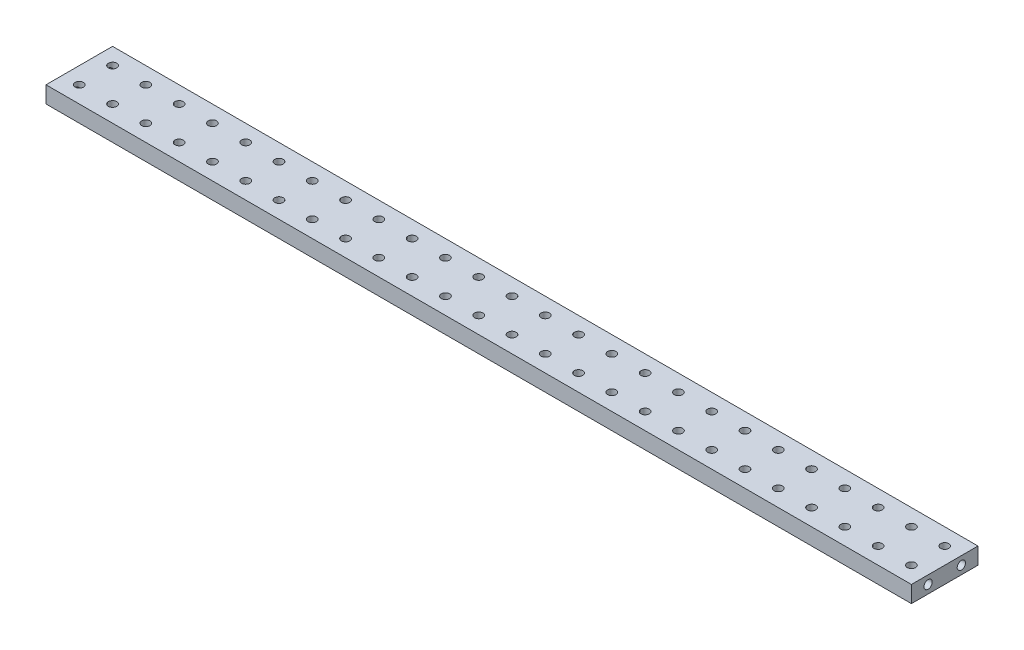
from build123d import *

# Parameters (mm, degrees)
SKETCH1_W           = 660.4
SKETCH1_H           = 50.8
BOSS_EXTRUDE1_DEPTH = 12.7
SKETCH2_R           = 3.175
CUT_EXTRUDE1_DEPTH  = 12.7
CUT_EXTRUDE2_START  = -12.7
SKETCH3_R           = 3.175
CUT_EXTRUDE2_DEPTH  = 12.7
SKETCH4_R           = 3.175
CUT_EXTRUDE3_DEPTH  = 332.418904108


with BuildPart() as part:
    # Sketch1 → Boss-Extrude1 (new body)
    with BuildSketch(Plane(origin=(0, 0, 0), x_dir=(1, 0, 0), z_dir=(0, 1, 0))):
        Rectangle(SKETCH1_W, SKETCH1_H)
    extrude(amount=BOSS_EXTRUDE1_DEPTH)

    # Sketch2 → Cut-Extrude1 (cut)
    with BuildSketch(Plane.ZY.offset(330.2)):
        with Locations((-12.7, 6.35)):
            Circle(SKETCH2_R)
        with Locations((12.7, 6.35)):
            Circle(SKETCH2_R)
    extrude(amount=-CUT_EXTRUDE1_DEPTH, mode=Mode.SUBTRACT)

    # Sketch3 → Cut-Extrude2 (cut)
    with BuildSketch(Plane(origin=(330.2, 0, 0), x_dir=(0, 0, -1), z_dir=(1, 0, 0)).offset(CUT_EXTRUDE2_START)):
        with Locations(Location((-12.7, 6.35, 0), (0, 0, 180))):
            Circle(SKETCH3_R)
        with Locations(Location((12.7, 6.35, 0), (0, 0, 180))):
            Circle(SKETCH3_R)
    extrude(amount=CUT_EXTRUDE2_DEPTH, mode=Mode.SUBTRACT)

    # Sketch4 → Cut-Extrude3 (cut, through all)
    with BuildSketch(Plane(origin=(0, 12.7, 0), x_dir=(1, 0, 0), z_dir=(0, 1, 0))):
        with Locations(Location((-317.5, 12.7, 0), (0, 0, 270))):
            Circle(SKETCH4_R)
        with Locations(Location((-292.1, 12.7, 0), (0, 0, 270))):
            Circle(SKETCH4_R)
        with Locations(Location((-266.7, 12.7, 0), (0, 0, 270))):
            Circle(SKETCH4_R)
        with Locations(Location((-241.3, 12.7, 0), (0, 0, 270))):
            Circle(SKETCH4_R)
        with Locations(Location((-215.9, 12.7, 0), (0, 0, 270))):
            Circle(SKETCH4_R)
        with Locations(Location((-190.5, 12.7, 0), (0, 0, 270))):
            Circle(SKETCH4_R)
        with Locations(Location((-165.1, 12.7, 0), (0, 0, 270))):
            Circle(SKETCH4_R)
        with Locations(Location((-139.7, 12.7, 0), (0, 0, 270))):
            Circle(SKETCH4_R)
        with Locations(Location((-114.3, 12.7, 0), (0, 0, 270))):
            Circle(SKETCH4_R)
        with Locations(Location((-88.9, 12.7, 0), (0, 0, 270))):
            Circle(SKETCH4_R)
        with Locations(Location((-63.5, 12.7, 0), (0, 0, 270))):
            Circle(SKETCH4_R)
        with Locations(Location((-38.1, 12.7, 0), (0, 0, 270))):
            Circle(SKETCH4_R)
        with Locations(Location((-12.7, 12.7, 0), (0, 0, 270))):
            Circle(SKETCH4_R)
        with Locations(Location((12.7, 12.7, 0), (0, 0, 270))):
            Circle(SKETCH4_R)
        with Locations(Location((38.1, 12.7, 0), (0, 0, 270))):
            Circle(SKETCH4_R)
        with Locations(Location((63.5, 12.7, 0), (0, 0, 270))):
            Circle(SKETCH4_R)
        with Locations(Location((88.9, 12.7, 0), (0, 0, 270))):
            Circle(SKETCH4_R)
        with Locations(Location((114.3, 12.7, 0), (0, 0, 270))):
            Circle(SKETCH4_R)
        with Locations(Location((139.7, 12.7, 0), (0, 0, 270))):
            Circle(SKETCH4_R)
        with Locations(Location((165.1, 12.7, 0), (0, 0, 270))):
            Circle(SKETCH4_R)
        with Locations(Location((190.5, 12.7, 0), (0, 0, 270))):
            Circle(SKETCH4_R)
        with Locations(Location((215.9, 12.7, 0), (0, 0, 270))):
            Circle(SKETCH4_R)
        with Locations(Location((241.3, 12.7, 0), (0, 0, 270))):
            Circle(SKETCH4_R)
        with Locations(Location((266.7, 12.7, 0), (0, 0, 270))):
            Circle(SKETCH4_R)
        with Locations(Location((-292.1, -12.7, 0), (0, 0, 270))):
            Circle(SKETCH4_R)
        with Locations(Location((-266.7, -12.7, 0), (0, 0, 270))):
            Circle(SKETCH4_R)
        with Locations(Location((-241.3, -12.7, 0), (0, 0, 270))):
            Circle(SKETCH4_R)
        with Locations(Location((-215.9, -12.7, 0), (0, 0, 270))):
            Circle(SKETCH4_R)
        with Locations(Location((-190.5, -12.7, 0), (0, 0, 270))):
            Circle(SKETCH4_R)
        with Locations(Location((-165.1, -12.7, 0), (0, 0, 270))):
            Circle(SKETCH4_R)
        with Locations(Location((-139.7, -12.7, 0), (0, 0, 270))):
            Circle(SKETCH4_R)
        with Locations(Location((-114.3, -12.7, 0), (0, 0, 270))):
            Circle(SKETCH4_R)
        with Locations(Location((-88.9, -12.7, 0), (0, 0, 270))):
            Circle(SKETCH4_R)
        with Locations(Location((-63.5, -12.7, 0), (0, 0, 270))):
            Circle(SKETCH4_R)
        with Locations(Location((-38.1, -12.7, 0), (0, 0, 270))):
            Circle(SKETCH4_R)
        with Locations(Location((-12.7, -12.7, 0), (0, 0, 270))):
            Circle(SKETCH4_R)
        with Locations(Location((12.7, -12.7, 0), (0, 0, 270))):
            Circle(SKETCH4_R)
        with Locations(Location((38.1, -12.7, 0), (0, 0, 270))):
            Circle(SKETCH4_R)
        with Locations(Location((63.5, -12.7, 0), (0, 0, 270))):
            Circle(SKETCH4_R)
        with Locations(Location((88.9, -12.7, 0), (0, 0, 270))):
            Circle(SKETCH4_R)
        with Locations(Location((114.3, -12.7, 0), (0, 0, 270))):
            Circle(SKETCH4_R)
        with Locations(Location((139.7, -12.7, 0), (0, 0, 270))):
            Circle(SKETCH4_R)
        with Locations(Location((165.1, -12.7, 0), (0, 0, 270))):
            Circle(SKETCH4_R)
        with Locations(Location((190.5, -12.7, 0), (0, 0, 270))):
            Circle(SKETCH4_R)
        with Locations(Location((215.9, -12.7, 0), (0, 0, 270))):
            Circle(SKETCH4_R)
        with Locations(Location((241.3, -12.7, 0), (0, 0, 270))):
            Circle(SKETCH4_R)
        with Locations(Location((266.7, -12.7, 0), (0, 0, 270))):
            Circle(SKETCH4_R)
        with Locations(Location((-317.5, -12.7, 0), (0, 0, 270))):
            Circle(SKETCH4_R)
        with Locations(Location((292.1, 12.7, 0), (0, 0, 270))):
            Circle(SKETCH4_R)
        with Locations(Location((317.5, 12.7, 0), (0, 0, 270))):
            Circle(SKETCH4_R)
        with Locations((342.9, 12.7)):
            Circle(SKETCH4_R)
        with Locations((368.3, 12.7)):
            Circle(SKETCH4_R)
        with Locations((393.7, 12.7)):
            Circle(SKETCH4_R)
        with Locations((419.1, 12.7)):
            Circle(SKETCH4_R)
        with Locations((444.5, 12.7)):
            Circle(SKETCH4_R)
        with Locations((469.9, 12.7)):
            Circle(SKETCH4_R)
        with Locations((495.3, 12.7)):
            Circle(SKETCH4_R)
        with Locations((520.7, 12.7)):
            Circle(SKETCH4_R)
        with Locations((546.1, 12.7)):
            Circle(SKETCH4_R)
        with Locations((571.5, 12.7)):
            Circle(SKETCH4_R)
        with Locations((596.9, 12.7)):
            Circle(SKETCH4_R)
        with Locations((622.3, 12.7)):
            Circle(SKETCH4_R)
        with Locations((647.7, 12.7)):
            Circle(SKETCH4_R)
        with Locations((673.1, 12.7)):
            Circle(SKETCH4_R)
        with Locations((698.5, 12.7)):
            Circle(SKETCH4_R)
        with Locations((723.9, 12.7)):
            Circle(SKETCH4_R)
        with Locations((749.3, 12.7)):
            Circle(SKETCH4_R)
        with Locations((774.7, 12.7)):
            Circle(SKETCH4_R)
        with Locations((800.1, 12.7)):
            Circle(SKETCH4_R)
        with Locations((825.5, 12.7)):
            Circle(SKETCH4_R)
        with Locations((850.9, 12.7)):
            Circle(SKETCH4_R)
        with Locations((876.3, 12.7)):
            Circle(SKETCH4_R)
        with Locations(Location((292.1, -12.7, 0), (0, 0, 270))):
            Circle(SKETCH4_R)
        with Locations(Location((317.5, -12.7, 0), (0, 0, 270))):
            Circle(SKETCH4_R)
        with Locations((342.9, -12.7)):
            Circle(SKETCH4_R)
        with Locations((368.3, -12.7)):
            Circle(SKETCH4_R)
        with Locations((393.7, -12.7)):
            Circle(SKETCH4_R)
        with Locations((419.1, -12.7)):
            Circle(SKETCH4_R)
        with Locations((444.5, -12.7)):
            Circle(SKETCH4_R)
        with Locations((469.9, -12.7)):
            Circle(SKETCH4_R)
        with Locations((495.3, -12.7)):
            Circle(SKETCH4_R)
        with Locations((520.7, -12.7)):
            Circle(SKETCH4_R)
        with Locations((546.1, -12.7)):
            Circle(SKETCH4_R)
        with Locations((571.5, -12.7)):
            Circle(SKETCH4_R)
        with Locations((596.9, -12.7)):
            Circle(SKETCH4_R)
        with Locations((622.3, -12.7)):
            Circle(SKETCH4_R)
        with Locations((647.7, -12.7)):
            Circle(SKETCH4_R)
        with Locations((673.1, -12.7)):
            Circle(SKETCH4_R)
        with Locations((698.5, -12.7)):
            Circle(SKETCH4_R)
        with Locations((723.9, -12.7)):
            Circle(SKETCH4_R)
        with Locations((749.3, -12.7)):
            Circle(SKETCH4_R)
        with Locations((774.7, -12.7)):
            Circle(SKETCH4_R)
        with Locations((800.1, -12.7)):
            Circle(SKETCH4_R)
        with Locations((825.5, -12.7)):
            Circle(SKETCH4_R)
        with Locations((850.9, -12.7)):
            Circle(SKETCH4_R)
        with Locations((876.3, -12.7)):
            Circle(SKETCH4_R)
    extrude(amount=-CUT_EXTRUDE3_DEPTH, mode=Mode.SUBTRACT)


solid = part.part
